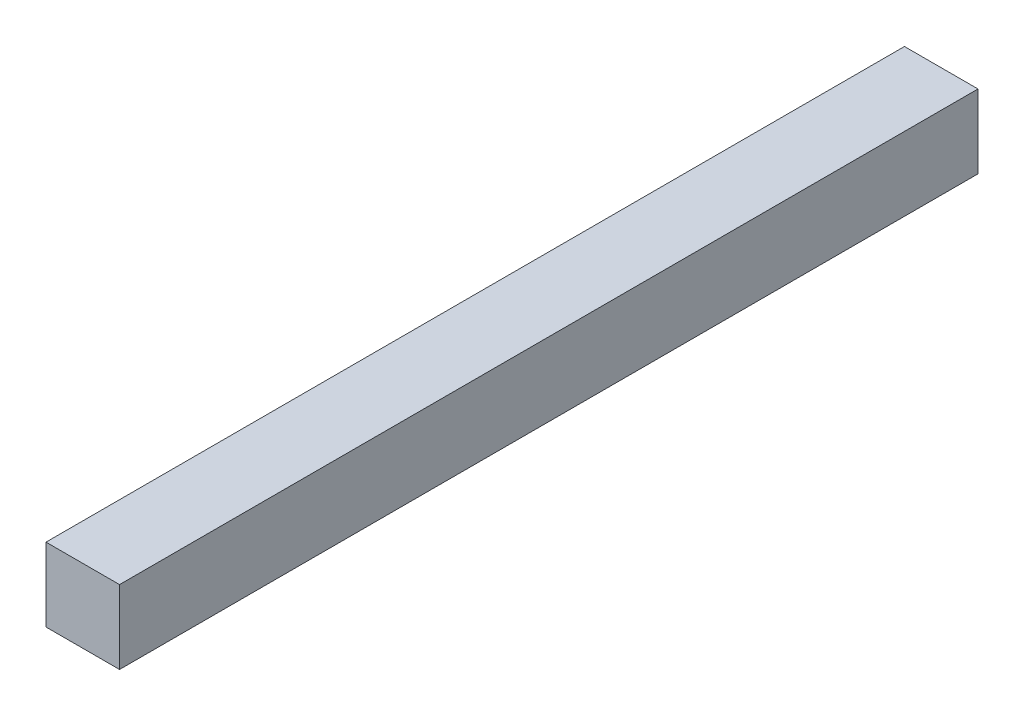
from build123d import *

# Parameters (mm, degrees)
SKETCH_1_W      = 30
SKETCH_1_H      = 30
EXTRUDE_1_DEPTH = 175.1


with BuildPart() as part:
    # 草图1 → 凸台-拉伸1 (new, symmetric)
    with BuildSketch(Plane.XY):
        Rectangle(SKETCH_1_W, SKETCH_1_H)
    extrude(amount=EXTRUDE_1_DEPTH, both=True)


solid = part.part
